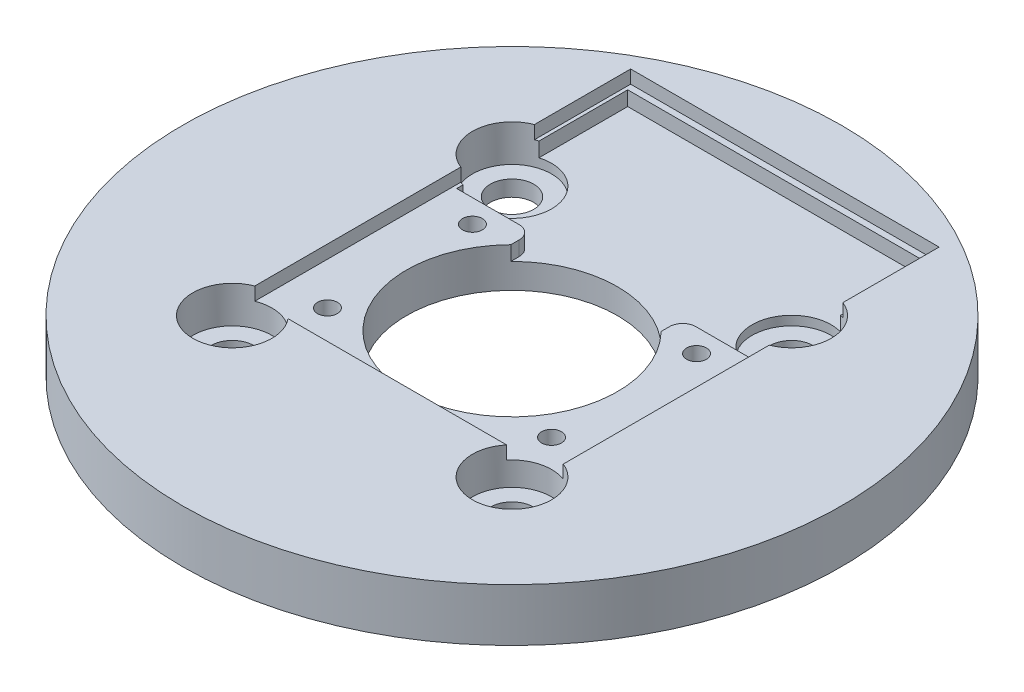
from build123d import *

# Parameters (mm, degrees)
SKETCH_1_R          = 25
SKETCH_1_R_2        = 8
SKETCH_1_R_3        = 1.65
EXTRUDE_1_DEPTH     = 4
SKETCH_5_W          = 23.4
SKETCH_5_H          = 29.4
CUT_EXTRUDE_1_DEPTH = 1
SKETCH_6_R          = 3
CUT_EXTRUDE_2_DEPTH = 2.8
CUT_EXTRUDE_3_REACH = 37.482
SKETCH_9_R          = 0.75
CUT_EXTRUDE_START   = -1.1
CUT_EXTRUDE_4_DEPTH = 1.1


with BuildPart() as part:
    # 草图1 → 凸台-拉伸1 (new body)
    with BuildSketch(Plane(origin=(0, 0, 0), x_dir=(1, 0, 0), z_dir=(0, 1, 0))):
        with Locations(Location((0, 0, 0), (0, 0, 270))):
            Circle(SKETCH_1_R)
        with Locations(Location((0, 0, 0), (0, 0, 270))):
            Circle(SKETCH_1_R_2, mode=Mode.SUBTRACT)
        with Locations(Location((10.606601718, 10.606601718, 0), (0, 0, 270))):
            Circle(SKETCH_1_R_3, mode=Mode.SUBTRACT)
        with Locations(Location((-10.606601718, 10.606601718, 0), (0, 0, 270))):
            Circle(SKETCH_1_R_3, mode=Mode.SUBTRACT)
        with Locations(Location((-10.606601718, -10.606601718, 0), (0, 0, 270))):
            Circle(SKETCH_1_R_3, mode=Mode.SUBTRACT)
        with Locations(Location((10.606601718, -10.606601718, 0), (0, 0, 270))):
            Circle(SKETCH_1_R_3, mode=Mode.SUBTRACT)
    extrude(amount=EXTRUDE_1_DEPTH)

    # 草图5 → 切除-拉伸1 (cut)
    with BuildSketch(Plane(origin=(0, 4, 0), x_dir=(1, 0, 0), z_dir=(0, 1, 0))):
        with Locations((0, 6)):
            Rectangle(SKETCH_5_W, SKETCH_5_H)
    extrude(amount=-CUT_EXTRUDE_1_DEPTH, mode=Mode.SUBTRACT)

    # 草图6 → 切除-拉伸2 (cut)
    with BuildSketch(Plane(origin=(0, 4, 0), x_dir=(1, 0, 0), z_dir=(0, 1, 0))):
        with Locations(Location((-10.606601718, 10.606601718, 0), (0, 0, 270))):
            Circle(SKETCH_6_R)
        with Locations(Location((10.606601718, 10.606601718, 0), (0, 0, 270))):
            Circle(SKETCH_6_R)
        with Locations(Location((10.606601718, -10.606601718, 0), (0, 0, 270))):
            Circle(SKETCH_6_R)
        with Locations(Location((-10.606601718, -10.606601718, 0), (0, 0, 270))):
            Circle(SKETCH_6_R)
    extrude(amount=-CUT_EXTRUDE_2_DEPTH, mode=Mode.SUBTRACT)

    # 草图9 → 切除-拉伸3 (cut, up to next)
    with BuildSketch(Plane(origin=(0, 3, 0), x_dir=(1, 0, 0), z_dir=(0, 1, 0)), mode=Mode.PRIVATE) as cut_extrude_3_sk1:
        with Locations(Location((-8.5, 5.5, 0), (0, 0, 270))):
            Circle(SKETCH_9_R)
    cut_extrude_3_tool1 = extrude(cut_extrude_3_sk1.sketch, amount=-CUT_EXTRUDE_3_REACH, mode=Mode.PRIVATE) & part.part
    # 草图9 → 切除-拉伸3 (cut, up to next)
    with BuildSketch(Plane(origin=(0, 3, 0), x_dir=(1, 0, 0), z_dir=(0, 1, 0)), mode=Mode.PRIVATE) as cut_extrude_3_sk2:
        with Locations(Location((8.5, 5.5, 0), (0, 0, 270))):
            Circle(SKETCH_9_R)
    cut_extrude_3_tool2 = extrude(cut_extrude_3_sk2.sketch, amount=-CUT_EXTRUDE_3_REACH, mode=Mode.PRIVATE) & part.part
    # 草图9 → 切除-拉伸3 (cut, up to next)
    with BuildSketch(Plane(origin=(0, 3, 0), x_dir=(1, 0, 0), z_dir=(0, 1, 0)), mode=Mode.PRIVATE) as cut_extrude_3_sk3:
        with Locations(Location((8.5, -5.5, 0), (0, 0, 270))):
            Circle(SKETCH_9_R)
    cut_extrude_3_tool3 = extrude(cut_extrude_3_sk3.sketch, amount=-CUT_EXTRUDE_3_REACH, mode=Mode.PRIVATE) & part.part
    # 草图9 → 切除-拉伸3 (cut, up to next)
    with BuildSketch(Plane(origin=(0, 3, 0), x_dir=(1, 0, 0), z_dir=(0, 1, 0)), mode=Mode.PRIVATE) as cut_extrude_3_sk4:
        with Locations(Location((-8.5, -5.5, 0), (0, 0, 270))):
            Circle(SKETCH_9_R)
    cut_extrude_3_tool4 = extrude(cut_extrude_3_sk4.sketch, amount=-CUT_EXTRUDE_3_REACH, mode=Mode.PRIVATE) & part.part
    add(cut_extrude_3_tool1.solids().sort_by_distance((-8.5, 3, -5.5))[0], mode=Mode.SUBTRACT)
    add(cut_extrude_3_tool2.solids().sort_by_distance((8.5, 3, -5.5))[0], mode=Mode.SUBTRACT)
    add(cut_extrude_3_tool3.solids().sort_by_distance((8.5, 3, 5.5))[0], mode=Mode.SUBTRACT)
    add(cut_extrude_3_tool4.solids().sort_by_distance((-8.5, 3, 5.5))[0], mode=Mode.SUBTRACT)

    # 草图10 → 切除-拉伸4 (cut)
    with BuildSketch(Plane(origin=(0, 3, 0), x_dir=(1, 0, 0), z_dir=(0, 1, 0)).offset(CUT_EXTRUDE_START)):
        with BuildLine():
            Line((-5.700788223, 5.612576381), (-5.700788223, 6.246626792))
            ThreePointArc((-5.700788223, 6.246626792), (-5.993681442, 6.953733574), (-6.700788223, 7.246626792))
            Line((-6.700788223, 7.246626792), (-11.441421376, 7.246626792))
            Line((-11.441421376, 7.246626792), (-11.441421376, 20.219080974))
            Line((-11.441421376, 20.219080974), (11.441421376, 20.219080974))
            Line((11.441421376, 20.219080974), (11.441421376, 7.246626792))
            Line((11.441421376, 7.246626792), (6.700788223, 7.246626792))
            ThreePointArc((6.700788223, 7.246626792), (5.993681442, 6.953733574), (5.700788223, 6.246626792))
            Line((5.700788223, 6.246626792), (5.700788223, 5.612576381))
            ThreePointArc((5.700788223, 5.612576381), (0, 8), (-5.700788223, 5.612576381))
        make_face()
    extrude(amount=CUT_EXTRUDE_4_DEPTH, mode=Mode.SUBTRACT)


solid = part.part
